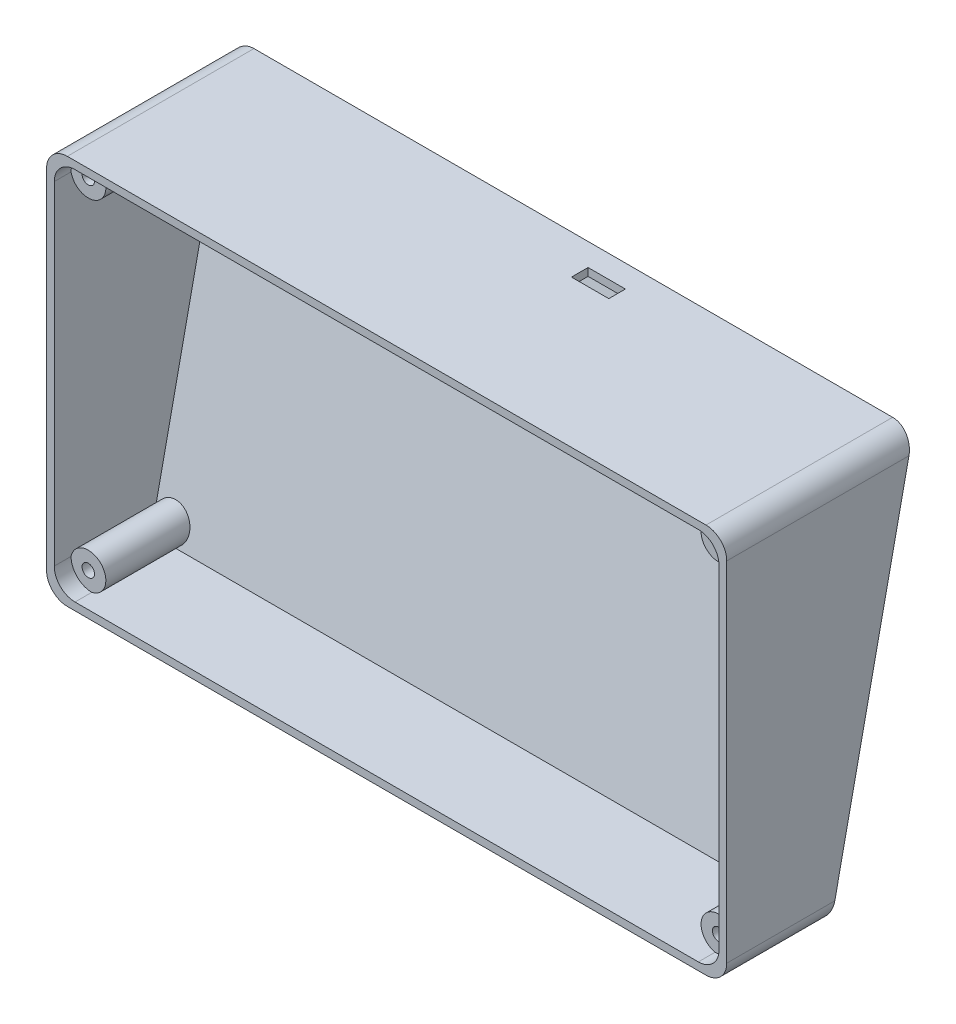
from build123d import *

# Parameters (mm, degrees)
SKIZZE1_W                       = 164
SKIZZE1_H                       = 94
AUFSATZ_LINEAR_AUSTRAGEN1_DEPTH = 25
AUFSATZ_LINEAR_AUSTRAGEN2_DEPTH = 164
SCHNITT_LINEAR_AUSTRAGEN1_REACH = 106.68
AUFSATZ_LINEAR_AUSTRAGEN3_REACH = 106.68
SKIZZE4_R                       = 4.236153916
SKIZZE4_R_2                     = 1.5
SCHNITT_LINEAR_AUSTRAGEN2_DEPTH = 4.05
VERRUNDUNG1_R                   = 5
SKIZZE7_W                       = 9
SKIZZE7_H                       = 4
SCHNITT_LINEAR_AUSTRAGEN4_DEPTH = 4.05
SKIZZE8_R                       = 5.5
SCHNITT_LINEAR_AUSTRAGEN5_DEPTH = 1


with BuildPart() as part:
    # Skizze1 → Aufsatz-Linear austragen1 (new body)
    with BuildSketch(Plane.XY):
        Rectangle(SKIZZE1_W, SKIZZE1_H)
    extrude(amount=AUFSATZ_LINEAR_AUSTRAGEN1_DEPTH)

    # Skizze2 → Aufsatz-Linear austragen2 (add)
    with BuildSketch(Plane(origin=(82, 0, 0), x_dir=(0, 0, -1), z_dir=(1, 0, 0))):
        Polygon((0, -47), (0, 47), (20, 47), align=None)
    extrude(amount=-AUFSATZ_LINEAR_AUSTRAGEN2_DEPTH)

    # Schnitt-Linear austragen1: up to this plane
    schnitt_linear_austragen1_end = Plane(origin=(-82, 47.416215289, -18.043788142), z_dir=(0, -0.20810764446485866, -0.9781059289848355))
    # Skizze3 → Schnitt-Linear austragen1 (cut, up to the surface)
    with BuildSketch(Plane.XY.offset(25), mode=Mode.PRIVATE) as schnitt_linear_austragen1_sk1:
        with BuildLine():
            Line((-75.15, -45.15), (75.15, -45.15))
            ThreePointArc((75.15, -45.15), (78.685533906, -43.685533906), (80.15, -40.15))
            Line((80.15, -40.15), (80.15, 40.15))
            ThreePointArc((80.15, 40.15), (78.685533906, 43.685533906), (75.15, 45.15))
            Line((75.15, 45.15), (-75.15, 45.15))
            ThreePointArc((-75.15, 45.15), (-78.685533906, 43.685533906), (-80.15, 40.15))
            Line((-80.15, 40.15), (-80.15, -40.15))
            ThreePointArc((-80.15, -40.15), (-78.685533906, -43.685533906), (-75.15, -45.15))
        make_face()
    schnitt_linear_austragen1_tool1 = split(extrude(schnitt_linear_austragen1_sk1.sketch, amount=-SCHNITT_LINEAR_AUSTRAGEN1_REACH, mode=Mode.PRIVATE), bisect_by=schnitt_linear_austragen1_end, keep=Keep.BOTH, mode=Mode.PRIVATE)
    add(schnitt_linear_austragen1_tool1.solids().sort_by_distance((0, 0, 25))[0], mode=Mode.SUBTRACT)

    # Aufsatz-Linear austragen3: up to this plane
    aufsatz_linear_austragen3_end = Plane(origin=(-82, 47.416215289, -18.043788142), z_dir=(0, -0.20810764446485866, -0.9781059289848355))
    # Skizze4 → Aufsatz-Linear austragen3 (add, up to the surface)
    with BuildSketch(Plane.XY.offset(25), mode=Mode.PRIVATE) as aufsatz_linear_austragen3_sk1:
        with Locations((-76, 41)):
            Circle(SKIZZE4_R)
        with Locations((-76, 41)):
            Circle(SKIZZE4_R_2, mode=Mode.SUBTRACT)
    aufsatz_linear_austragen3_tool1 = split(extrude(aufsatz_linear_austragen3_sk1.sketch, amount=-AUFSATZ_LINEAR_AUSTRAGEN3_REACH, mode=Mode.PRIVATE), bisect_by=aufsatz_linear_austragen3_end, keep=Keep.BOTH, mode=Mode.PRIVATE)
    add(aufsatz_linear_austragen3_tool1.solids().sort_by_distance((-80.116337, 41, 25))[0])
    # Skizze4 → Aufsatz-Linear austragen3 (add, up to the surface)
    with BuildSketch(Plane.XY.offset(25), mode=Mode.PRIVATE) as aufsatz_linear_austragen3_sk2:
        with Locations((-76, -41)):
            Circle(SKIZZE4_R)
        with Locations((-76, -41)):
            Circle(SKIZZE4_R_2, mode=Mode.SUBTRACT)
    aufsatz_linear_austragen3_tool2 = split(extrude(aufsatz_linear_austragen3_sk2.sketch, amount=-AUFSATZ_LINEAR_AUSTRAGEN3_REACH, mode=Mode.PRIVATE), bisect_by=aufsatz_linear_austragen3_end, keep=Keep.BOTH, mode=Mode.PRIVATE)
    add(aufsatz_linear_austragen3_tool2.solids().sort_by_distance((-80.116337, -41, 25))[0])
    # Skizze4 → Aufsatz-Linear austragen3 (add, up to the surface)
    with BuildSketch(Plane.XY.offset(25), mode=Mode.PRIVATE) as aufsatz_linear_austragen3_sk3:
        with Locations((76, -41)):
            Circle(SKIZZE4_R)
        with Locations((76, -41)):
            Circle(SKIZZE4_R_2, mode=Mode.SUBTRACT)
    aufsatz_linear_austragen3_tool3 = split(extrude(aufsatz_linear_austragen3_sk3.sketch, amount=-AUFSATZ_LINEAR_AUSTRAGEN3_REACH, mode=Mode.PRIVATE), bisect_by=aufsatz_linear_austragen3_end, keep=Keep.BOTH, mode=Mode.PRIVATE)
    add(aufsatz_linear_austragen3_tool3.solids().sort_by_distance((71.883663, -41, 25))[0])
    # Skizze4 → Aufsatz-Linear austragen3 (add, up to the surface)
    with BuildSketch(Plane.XY.offset(25), mode=Mode.PRIVATE) as aufsatz_linear_austragen3_sk4:
        with Locations((76, 41)):
            Circle(SKIZZE4_R)
        with Locations((76, 41)):
            Circle(SKIZZE4_R_2, mode=Mode.SUBTRACT)
    aufsatz_linear_austragen3_tool4 = split(extrude(aufsatz_linear_austragen3_sk4.sketch, amount=-AUFSATZ_LINEAR_AUSTRAGEN3_REACH, mode=Mode.PRIVATE), bisect_by=aufsatz_linear_austragen3_end, keep=Keep.BOTH, mode=Mode.PRIVATE)
    add(aufsatz_linear_austragen3_tool4.solids().sort_by_distance((71.883663, 41, 25))[0])

    # Skizze6 → Schnitt-Linear austragen2 (cut)
    with BuildSketch(Plane.XY.offset(25)):
        with BuildLine():
            Line((-75.15, -45.15), (75.15, -45.15))
            ThreePointArc((75.15, -45.15), (78.685533906, -43.685533906), (80.15, -40.15))
            Line((80.15, -40.15), (80.15, 40.15))
            ThreePointArc((80.15, 40.15), (78.685533906, 43.685533906), (75.15, 45.15))
            Line((75.15, 45.15), (-75.15, 45.15))
            ThreePointArc((-75.15, 45.15), (-78.685533906, 43.685533906), (-80.15, 40.15))
            Line((-80.15, 40.15), (-80.15, -40.15))
            ThreePointArc((-80.15, -40.15), (-78.685533906, -43.685533906), (-75.15, -45.15))
        make_face()
    extrude(amount=-SCHNITT_LINEAR_AUSTRAGEN2_DEPTH, mode=Mode.SUBTRACT)

    # Verrundung1
    verrundung1_edges = [part.edges().sort_by_distance(p)[0] for p in [
        (82, -47, 12.5),
        (-82, -47, 12.5),
        (-82, 47, 2.5),
        (82, 47, 2.5),
    ]]
    fillet(verrundung1_edges, radius=VERRUNDUNG1_R)

    # Skizze7 → Schnitt-Linear austragen4 (cut)
    with BuildSketch(Plane(origin=(0, 47, 0), x_dir=(1, 0, 0), z_dir=(0, 1, 0))):
        with Locations((13.5, 12.561614676)):
            Rectangle(SKIZZE7_W, SKIZZE7_H)
    extrude(amount=-SCHNITT_LINEAR_AUSTRAGEN4_DEPTH, mode=Mode.SUBTRACT)

    # Skizze8 → Schnitt-Linear austragen5 (cut)
    with BuildSketch(Plane(origin=(0, -2.035513209, -9.566912083), x_dir=(-1, 0, 0), z_dir=(0, -0.20810764446485866, -0.9781059289848355))):
        with Locations(Location((-72, 40.133131552, 0), (0, 0, 90))):
            Circle(SKIZZE8_R)
        with Locations(Location((72, 40.133131552, 0), (0, 0, 90))):
            Circle(SKIZZE8_R)
        with Locations(Location((72, -35.970978662, 0), (0, 0, 90))):
            Circle(SKIZZE8_R)
        with Locations(Location((-72, -35.970978662, 0), (0, 0, 90))):
            Circle(SKIZZE8_R)
    extrude(amount=-SCHNITT_LINEAR_AUSTRAGEN5_DEPTH, mode=Mode.SUBTRACT)


solid = part.part
